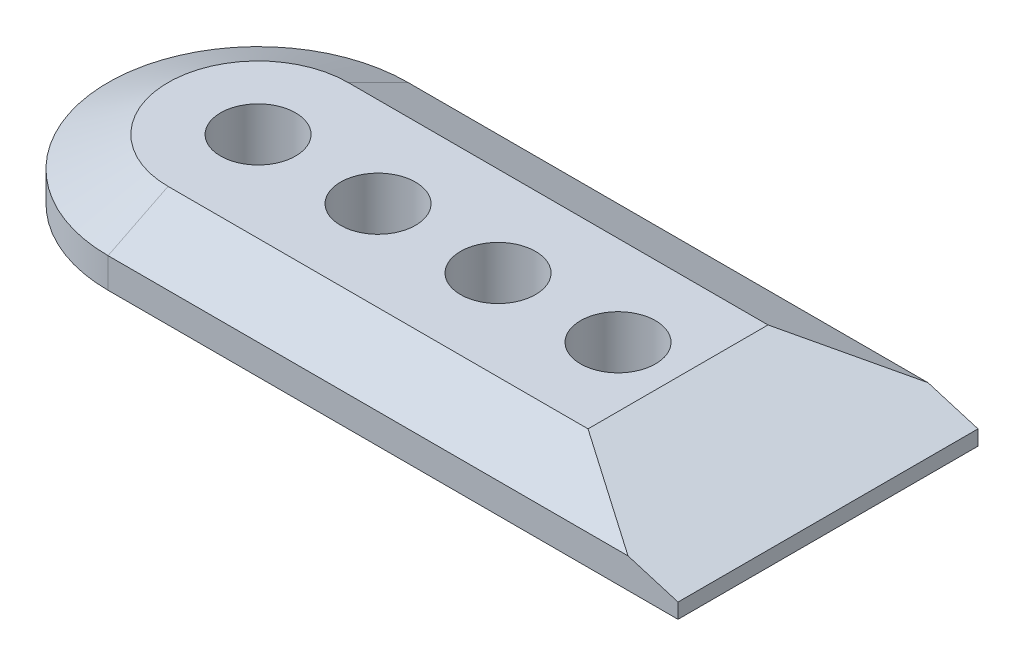
from build123d import *
from OCP.BRepFilletAPI import BRepFilletAPI_MakeChamfer

# Parameters (mm, degrees)
BOSS_EXTRUDE1_DEPTH = 12.7
CHAMFER1_SIZE       = 6.35
CHAMFER1_SIZE2      = 12.7
CHAMFER2_SIZE       = 9.525
CHAMFER2_SIZE2      = 31.75
SKETCH2_R           = 7.9375
CUT_EXTRUDE3_DEPTH  = 126.402456309


with BuildPart() as part:
    # Sketch1 → Boss-Extrude1 (new body)
    with BuildSketch(Plane(origin=(0, 0, 0), x_dir=(1, 0, 0), z_dir=(0, 1, 0))):
        with BuildLine():
            Line((4.345e-06, -31.75), (120.650004345, -31.75))
            Line((120.650004345, -31.75), (120.650004345, 31.75))
            Line((120.650004345, 31.75), (0, 31.75))
            ThreePointArc((0, 31.75), (-31.75, -2.172e-06), (4.345e-06, -31.75))
        make_face()
    extrude(amount=BOSS_EXTRUDE1_DEPTH)

    # Chamfer1: one chamfer whose edges measure the first distance from different faces: ONE call of the kernel's chamfer builder (chamfer() names one face for all edges)
    chamfer1_edges_1 = [part.edges().sort_by_distance(p)[0] for p in [
        (60.325002172, 12.7, -31.75),
    ]]
    chamfer1_side_1 = [part.faces().sort_by_distance(p)[0] for p in [
        (60.325002172, 6.35, -31.75),
    ]]
    chamfer1_edges_2 = [part.edges().sort_by_distance(p)[0] for p in [
        (-31.75, 12.7, 2.172e-06),
    ]]
    chamfer1_side_2 = [part.faces().sort_by_distance(p)[0] for p in [
        (-31.75, 6.35, 2.172e-06),
    ]]
    chamfer1_edges_3 = [part.edges().sort_by_distance(p)[0] for p in [
        (60.325004345, 12.7, 31.75),
    ]]
    chamfer1_side_3 = [part.faces().sort_by_distance(p)[0] for p in [
        (60.325004345, 6.35, 31.75),
    ]]
    chamfer1 = BRepFilletAPI_MakeChamfer(part.part.solid().wrapped)
    for e in chamfer1_edges_1:
        chamfer1.Add(CHAMFER1_SIZE, CHAMFER1_SIZE2, e.wrapped, chamfer1_side_1[0].wrapped)  # the first distance lies on this face
    for e in chamfer1_edges_2:
        chamfer1.Add(CHAMFER1_SIZE, CHAMFER1_SIZE2, e.wrapped, chamfer1_side_2[0].wrapped)  # the first distance lies on this face
    for e in chamfer1_edges_3:
        chamfer1.Add(CHAMFER1_SIZE, CHAMFER1_SIZE2, e.wrapped, chamfer1_side_3[0].wrapped)  # the first distance lies on this face
    add(Compound.cast(chamfer1.Shape()), mode=Mode.REPLACE)

    # Chamfer2
    chamfer2_edges = [part.edges().sort_by_distance(p)[0] for p in [
        (120.650004345, 12.7, 0),
    ]]
    chamfer2_side = [part.faces().sort_by_distance(p)[0] for p in [
        (120.650004345, 5.87962963, 0),
    ]]
    chamfer(chamfer2_edges, length=CHAMFER2_SIZE, length2=CHAMFER2_SIZE2, reference=chamfer2_side[0])

    # Sketch2 → Cut-Extrude3 (cut, through all)
    with BuildSketch(Plane(origin=(0, 0, 0), x_dir=(1, 0, 0), z_dir=(0, 1, 0))):
        with Locations(Location((0, 0, 0), (0, 0, 270))):
            Circle(SKETCH2_R)
        with Locations(Location((25.4, 0, 0), (0, 0, 270))):
            Circle(SKETCH2_R)
        with Locations(Location((50.8, 0, 0), (0, 0, 270))):
            Circle(SKETCH2_R)
        with Locations(Location((76.2, 0, 0), (0, 0, 270))):
            Circle(SKETCH2_R)
    extrude(amount=CUT_EXTRUDE3_DEPTH, mode=Mode.SUBTRACT)


solid = part.part
